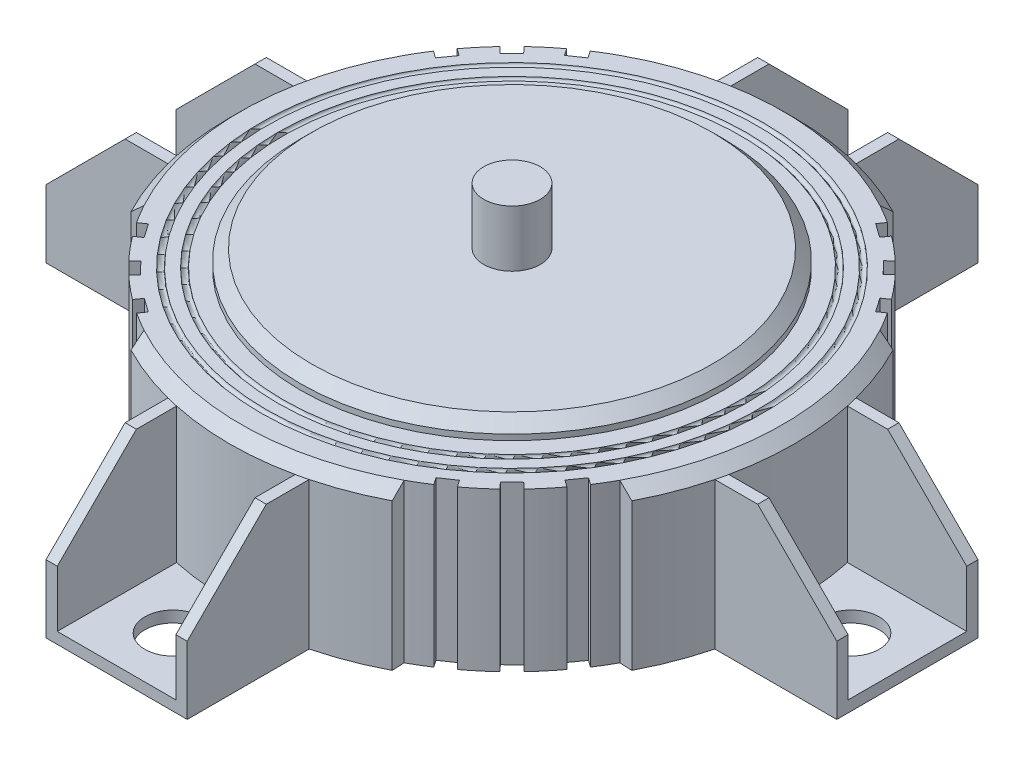
from build123d import *

# Parameters (mm, degrees)
CHAMFER1_SIZE                   = 2
BOSS_EXTRUDE1_DEPTH             = 70
CHAMFER3_SIZE                   = 14
SKETCH7_R                       = 5
CUT_EXTRUDE1_DEPTH              = 70
CIRPATTERN4_COUNT               = 4
CHAMFER3_OF_CIRPATTERN4_SIZE    = 14
CUT_EXTRUDE3_START              = 70
CUT_EXTRUDE3_DEPTH              = 70
CUT_EXTRUDE4_DEPTH              = 70
CIRPATTERN5_COUNT               = 2
CIRPATTERN5_ANGLE               = 10
CIRPATTERN5_THE_OTHER_WAY_COUNT = 2
CIRPATTERN5_THE_OTHER_WAY_ANGLE = 10
CIRPATTERN7_COUNT               = 4
CIRPATTERN7_COPY_1_DEPTH        = 70
CIRPATTERN7_COPY_2_DEPTH        = 70
CIRPATTERN7_COPY_3_DEPTH        = 70
CIRPATTERN7_COPY_4_DEPTH        = 70
CIRPATTERN7_COPY_5_DEPTH        = 70
CIRPATTERN7_COPY_6_DEPTH        = 70
CUT_SWEEP2_PROFILE_R            = 0.5
CUT_SWEEP9_PROFILE_R            = 0.5
CUT_EXTRUDE5_START              = -10
SKETCH109_R                     = 37.5
CUT_EXTRUDE5_DEPTH              = 10


with BuildPart() as part:
    # Sketch1 → Revolve1 (revolve)
    with BuildSketch(Plane.XY, mode=Mode.PRIVATE) as revolve1_sk:
        Polygon((0, 0), (-50, 0), (-50, 28), (-37.5, 28), (-37.5, 31), (-5, 31), (-5, 41), (0, 41), align=None)
    revolve(revolve1_sk.sketch.rotate(Axis((0, 0, 0), (0, 1, 0)), 270), axis=Axis((0, 0, 0), (0, 1, 0)))

    # Chamfer1
    chamfer1_edges = [part.edges().sort_by_distance(p)[0] for p in [
        (0, 31, 37.5),
        (0, 28, 50),
    ]]
    chamfer(chamfer1_edges, length=CHAMFER1_SIZE)

    # Sketch3 → Boss-Extrude1 (add)
    with BuildSketch(Plane.XY):
        Polygon((-12.5, 26), (-12.5, 0), (12.5, 0), (12.5, 26), (10.5, 26), (10.5, 2), (-10.5, 2), (-10.5, 26), align=None)
    boss_extrude1 = extrude(amount=BOSS_EXTRUDE1_DEPTH)

    # Chamfer3
    chamfer3_edges = [part.edges().sort_by_distance(p)[0] for p in [
        (11.5, 26, 70),
        (-11.5, 26, 70),
    ]]
    chamfer(chamfer3_edges, length=CHAMFER3_SIZE)

    # Sketch7 → Cut-Extrude1 (cut)
    with BuildSketch(Plane(origin=(0, 0, 0), x_dir=(1, 0, 0), z_dir=(0, 1, 0))):
        with Locations(Location((0, -60, 0), (0, 0, 90))):
            Circle(SKETCH7_R)
    cut_extrude1 = extrude(amount=CUT_EXTRUDE1_DEPTH, mode=Mode.SUBTRACT)

    # CirPattern4: Boss-Extrude1, Cut-Extrude1 ×4 about axis
    cirpattern4_axis = Axis((0, 0, 0), (0, 1, 0))
    add([boss_extrude1.rotate(cirpattern4_axis, i * 360 / CIRPATTERN4_COUNT) for i in range(1, CIRPATTERN4_COUNT)])
    add([cut_extrude1.rotate(cirpattern4_axis, i * 360 / CIRPATTERN4_COUNT) for i in range(1, CIRPATTERN4_COUNT)], mode=Mode.SUBTRACT)

    # Chamfer3 of CirPattern4
    chamfer3_of_cirpattern4_edges = [part.edges().sort_by_distance(p)[0] for p in [
        (70, 26, -11.5),
        (70, 26, 11.5),
        (-11.5, 26, -70),
        (11.5, 26, -70),
        (-70, 26, 11.5),
        (-70, 26, -11.5),
    ]]
    chamfer(chamfer3_of_cirpattern4_edges, length=CHAMFER3_OF_CIRPATTERN4_SIZE)

    # Sketch12 → Cut-Extrude3 (cut)
    with BuildSketch(Plane(origin=(0, 0, 0), x_dir=(1, 0, 0), z_dir=(0, 1, 0)).offset(CUT_EXTRUDE3_START)):
        with BuildLine():
            Line((23.02513458, -42.117017672), (23.12024219, -44.333445626))
            ThreePointArc((23.12024219, -44.333445626), (35.355339059, -35.355339059), (44.333445626, -23.12024219))
            Line((44.333445626, -23.12024219), (42.117017672, -23.02513458))
            ThreePointArc((42.117017672, -23.02513458), (33.941125497, -33.941125497), (23.02513458, -42.117017672))
        make_face()
    cut_extrude3 = extrude(amount=-CUT_EXTRUDE3_DEPTH, mode=Mode.SUBTRACT)

    # Sketch19 → Cut-Extrude4 (cut)
    with BuildSketch(Plane(origin=(0, 0, 0), x_dir=(1, 0, 0), z_dir=(0, 1, 0))):
        Polygon((36.062317099, -33.941125497), (33.917754876, -36.038946478), (31.819933895, -33.894384255), (33.964496118, -31.796563274), align=None)
    cut_extrude4 = extrude(amount=CUT_EXTRUDE4_DEPTH, mode=Mode.SUBTRACT)

    # CirPattern5: Cut-Extrude4 ×2 about axis
    cirpattern5_axis = Axis((0, 0, 0), (0, -1, 0))
    for i in range(1, CIRPATTERN5_COUNT):
        add(cut_extrude4.rotate(cirpattern5_axis, i * CIRPATTERN5_ANGLE / (CIRPATTERN5_COUNT - 1)), mode=Mode.SUBTRACT)

    # CirPattern5 the other way: Cut-Extrude4 ×2 about axis
    cirpattern5_the_other_way_axis = Axis((0, 0, 0), (0, 1, 0))
    for i in range(1, CIRPATTERN5_THE_OTHER_WAY_COUNT):
        add(cut_extrude4.rotate(cirpattern5_the_other_way_axis, i * CIRPATTERN5_THE_OTHER_WAY_ANGLE / (CIRPATTERN5_THE_OTHER_WAY_COUNT - 1)), mode=Mode.SUBTRACT)

    # CirPattern7: Cut-Extrude3, Cut-Extrude4 ×4 about axis
    cirpattern7_axis = Axis((0, 0, 0), (0, 1, 0))
    add([cut_extrude3.rotate(cirpattern7_axis, i * 360 / CIRPATTERN7_COUNT) for i in range(1, CIRPATTERN7_COUNT)], mode=Mode.SUBTRACT)
    add([cut_extrude4.rotate(cirpattern7_axis, i * 360 / CIRPATTERN7_COUNT) for i in range(1, CIRPATTERN7_COUNT)], mode=Mode.SUBTRACT)

    # CirPattern7 copy 1 sketch → CirPattern7 copy 1 (cut)
    with BuildSketch(Plane(origin=(0, 0, 0), x_dir=(0.1736481776669308, 0, -0.984807753012208), z_dir=(0, 1, 0))):
        Polygon((36.062317099, -33.941125497), (33.917754876, -36.038946478), (31.819933895, -33.894384255), (33.964496118, -31.796563274), align=None)
    extrude(amount=CIRPATTERN7_COPY_1_DEPTH, mode=Mode.SUBTRACT)

    # CirPattern7 copy 2 sketch → CirPattern7 copy 2 (cut)
    with BuildSketch(Plane(origin=(0, 0, 0), x_dir=(-0.984807753012208, 0, -0.17364817766693086), z_dir=(0, 1, 0))):
        Polygon((36.062317099, -33.941125497), (33.917754876, -36.038946478), (31.819933895, -33.894384255), (33.964496118, -31.796563274), align=None)
    extrude(amount=CIRPATTERN7_COPY_2_DEPTH, mode=Mode.SUBTRACT)

    # CirPattern7 copy 3 sketch → CirPattern7 copy 3 (cut)
    with BuildSketch(Plane(origin=(0, 0, 0), x_dir=(-0.17364817766693094, 0, 0.984807753012208), z_dir=(0, 1, 0))):
        Polygon((36.062317099, -33.941125497), (33.917754876, -36.038946478), (31.819933895, -33.894384255), (33.964496118, -31.796563274), align=None)
    extrude(amount=CIRPATTERN7_COPY_3_DEPTH, mode=Mode.SUBTRACT)

    # CirPattern7 copy 4 sketch → CirPattern7 copy 4 (cut)
    with BuildSketch(Plane(origin=(0, 0, 0), x_dir=(-0.1736481776669307, 0, -0.984807753012208), z_dir=(0, 1, 0))):
        Polygon((36.062317099, -33.941125497), (33.917754876, -36.038946478), (31.819933895, -33.894384255), (33.964496118, -31.796563274), align=None)
    extrude(amount=CIRPATTERN7_COPY_4_DEPTH, mode=Mode.SUBTRACT)

    # CirPattern7 copy 5 sketch → CirPattern7 copy 5 (cut)
    with BuildSketch(Plane(origin=(0, 0, 0), x_dir=(-0.984807753012208, 0, 0.17364817766693064), z_dir=(0, 1, 0))):
        Polygon((36.062317099, -33.941125497), (33.917754876, -36.038946478), (31.819933895, -33.894384255), (33.964496118, -31.796563274), align=None)
    extrude(amount=CIRPATTERN7_COPY_5_DEPTH, mode=Mode.SUBTRACT)

    # CirPattern7 copy 6 sketch → CirPattern7 copy 6 (cut)
    with BuildSketch(Plane(origin=(0, 0, 0), x_dir=(0.17364817766693055, 0, 0.984807753012208), z_dir=(0, 1, 0))):
        Polygon((36.062317099, -33.941125497), (33.917754876, -36.038946478), (31.819933895, -33.894384255), (33.964496118, -31.796563274), align=None)
    extrude(amount=CIRPATTERN7_COPY_6_DEPTH, mode=Mode.SUBTRACT)

    # Cut-Sweep2: sweep along a path in Sketch27
    with BuildLine(Plane(origin=(0, 28, 0), x_dir=(1, 0, 0), z_dir=(0, 1, 0))) as cut_sweep2_path:
        CenterArc((0, 0), 41, 0, 360)
    # Cut-Sweep2 profile (on start of the path) → Cut-Sweep2 (sweep, cut)
    with BuildSketch(Plane(origin=(41, 28, 0), x_dir=(-1, 0, 0), z_dir=(0, 0, -1))):
        Circle(CUT_SWEEP2_PROFILE_R)
    sweep(path=cut_sweep2_path.line, mode=Mode.SUBTRACT)

    # Cut-Sweep9: sweep along a path in Sketch102
    with BuildLine(Plane(origin=(0, 28, 0), x_dir=(1, 0, 0), z_dir=(0, 1, 0))) as cut_sweep9_path:
        CenterArc((0, 0), 44, 0, 360)
    # Cut-Sweep9 profile (on start of the path) → Cut-Sweep9 (sweep, cut)
    with BuildSketch(Plane(origin=(44, 28, 0), x_dir=(-1, 0, 0), z_dir=(0, 0, -1))):
        Circle(CUT_SWEEP9_PROFILE_R)
    sweep(path=cut_sweep9_path.line, mode=Mode.SUBTRACT)

    # Sketch109 → Cut-Extrude5 (cut)
    with BuildSketch(Plane(origin=(0, 0, 0), x_dir=(-1, 0, 0), z_dir=(0, -1, 0)).offset(CUT_EXTRUDE5_START)):
        with Locations(Location((0, 0, 0), (0, 0, 90))):
            Circle(SKETCH109_R)
    extrude(amount=CUT_EXTRUDE5_DEPTH, mode=Mode.SUBTRACT)


solid = part.part
